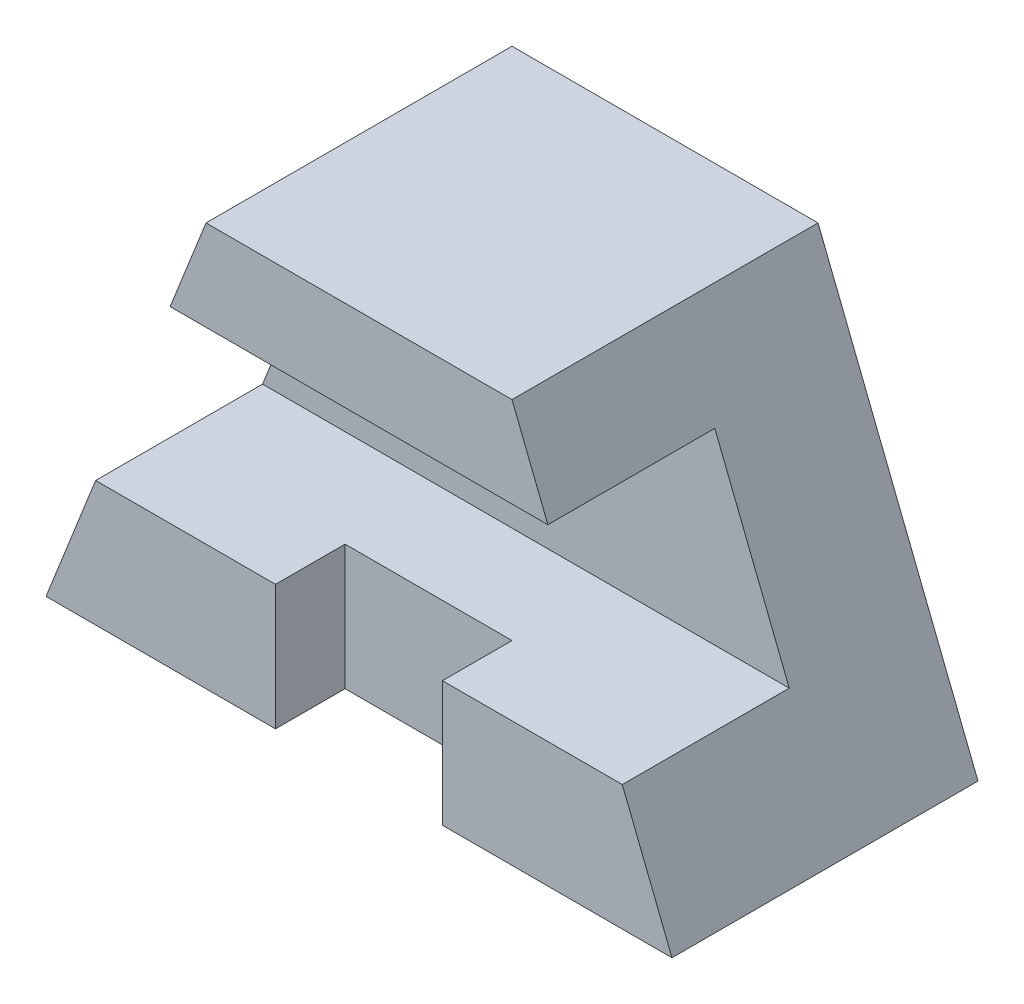
from build123d import *

# Parameters (mm, degrees)
SKETCH1_W           = 90
SKETCH1_H           = 58
BOSS_EXTRUDE1_DEPTH = 22
SKETCH2_W           = 90
SKETCH2_H           = 27
CUT_EXTRUDE1_DEPTH  = 24
CUT_EXTRUDE2_DEPTH  = 86.586213843
CUT_EXTRUDE3_REACH  = 78.636
SKETCH4_W           = 24
SKETCH4_H           = 10


with BuildPart() as part:
    # Sketch1 → Boss-Extrude1 (new, symmetric)
    with BuildSketch(Plane.XY):
        with Locations((0, 29)):
            Rectangle(SKETCH1_W, SKETCH1_H)
    extrude(amount=BOSS_EXTRUDE1_DEPTH, both=True)

    # Sketch2 → Cut-Extrude1 (cut)
    with BuildSketch(Plane.XY.offset(22)):
        with Locations((0, 31.5)):
            Rectangle(SKETCH2_W, SKETCH2_H)
    extrude(amount=-CUT_EXTRUDE1_DEPTH, mode=Mode.SUBTRACT)

    # Sketch3 → Cut-Extrude2 (cut, through all)
    with BuildSketch(Plane(origin=(0, 0, -22), x_dir=(-1, 0, 0), z_dir=(0, 0, -1))):
        Polygon((-45, 58), (-45, 0), (-22, 58), align=None)
    cut_extrude2 = extrude(amount=-CUT_EXTRUDE2_DEPTH, mode=Mode.SUBTRACT)

    # Mirror1: Cut-Extrude2 across plane
    add(cut_extrude2.mirror(Plane(origin=(0, 0, 0), x_dir=(0, 0, 1), z_dir=(1, 0, 0))), mode=Mode.SUBTRACT)

    # Sketch4 → Cut-Extrude3 (cut, up to next)
    with BuildSketch(Plane.XZ, mode=Mode.PRIVATE) as cut_extrude3_sk1:
        with Locations((0, 17)):
            Rectangle(SKETCH4_W, SKETCH4_H)
    cut_extrude3_tool1 = extrude(cut_extrude3_sk1.sketch, amount=-CUT_EXTRUDE3_REACH, mode=Mode.PRIVATE) & part.part
    add(cut_extrude3_tool1.solids().sort_by_distance((0, 0, 17))[0], mode=Mode.SUBTRACT)


solid = part.part
